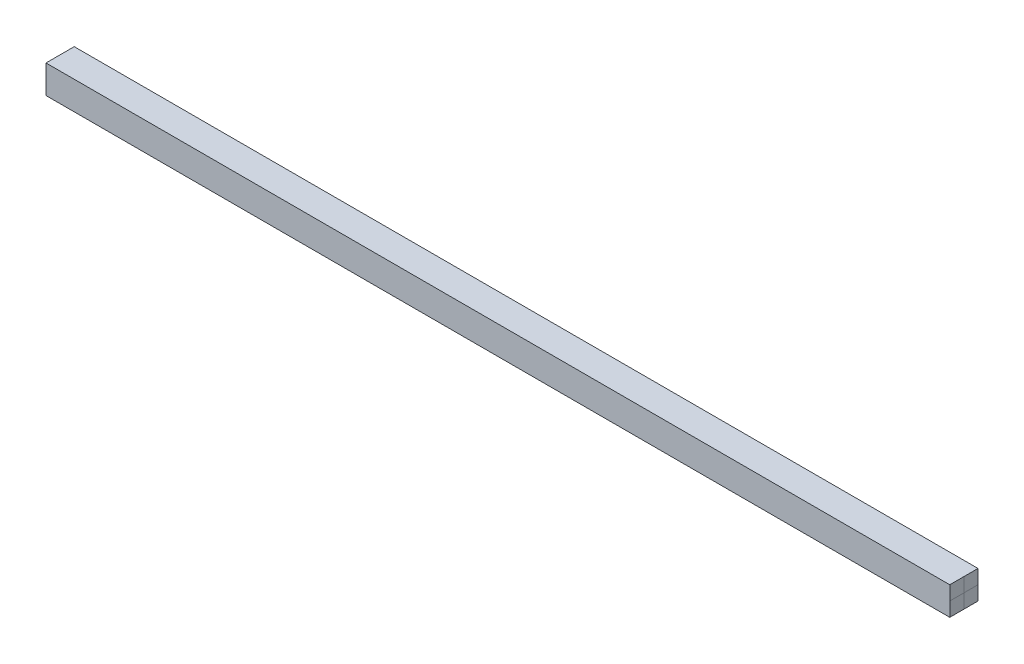
from build123d import *

# Parameters (mm, degrees)
SKETCH6_W      = 100
SKETCH6_H      = 100
EXTRUDE2_DEPTH = 3200


with BuildPart() as part:
    # Sketch6 → Extrude2 (new body)
    with BuildSketch(Plane(origin=(0, 0, 0), x_dir=(0, 0, -1), z_dir=(1, 0, 0))):
        Rectangle(SKETCH6_W, SKETCH6_H)
    extrude(amount=EXTRUDE2_DEPTH)


solid = part.part
